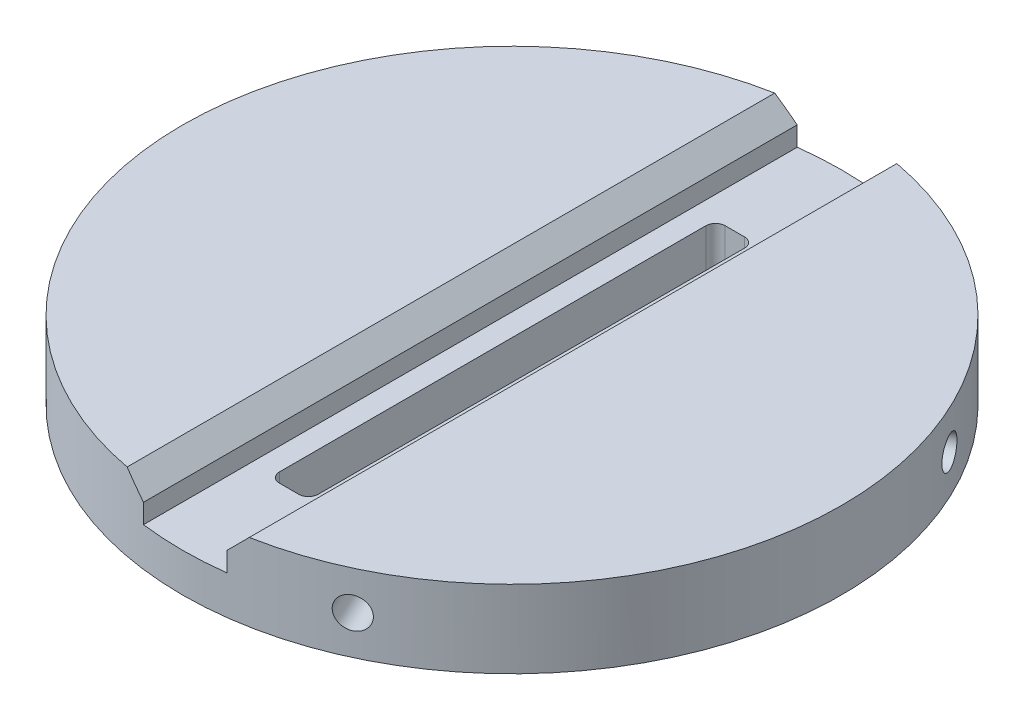
from build123d import *

# Parameters (mm, degrees)
SKETCH1_R           = 17
BOSS_EXTRUDE1_DEPTH = 4
SKETCH23_W          = 4.3
SKETCH23_H          = 36
CUT_EXTRUDE5_DEPTH  = 2
SKETCH24_W          = 2
SKETCH24_H          = 23
CUT_EXTRUDE6_DEPTH  = 25.124676164
FILLET4_R           = 0.5
CHAMFER1_SIZE       = 1
CIRPATTERN1_COUNT   = 4


with BuildPart() as part:
    # Sketch1 → Boss-Extrude1 (new body)
    with BuildSketch(Plane(origin=(0, 0, 0), x_dir=(1, 0, 0), z_dir=(0, 1, 0))):
        with Locations(Location((0, 0, 0), (0, 0, 270))):
            Circle(SKETCH1_R)
    extrude(amount=BOSS_EXTRUDE1_DEPTH)

    # Sketch23 → Cut-Extrude5 (cut)
    with BuildSketch(Plane(origin=(0, 4, 0), x_dir=(1, 0, 0), z_dir=(0, 1, 0))):
        with Locations((0, -0.174485126)):
            Rectangle(SKETCH23_W, SKETCH23_H)
    extrude(amount=-CUT_EXTRUDE5_DEPTH, mode=Mode.SUBTRACT)

    # Sketch24 → Cut-Extrude6 (cut, through all)
    with BuildSketch(Plane(origin=(0, 2, 0), x_dir=(1, 0, 0), z_dir=(0, 1, 0))):
        Rectangle(SKETCH24_W, SKETCH24_H)
    extrude(amount=-CUT_EXTRUDE6_DEPTH, mode=Mode.SUBTRACT)

    # Fillet4
    fillet4_edges = [part.edges().sort_by_distance(p)[0] for p in [
        (1, 1, -11.5),
        (1, 1, 11.5),
        (-1, 1, 11.5),
        (-1, 1, -11.5),
    ]]
    fillet(fillet4_edges, radius=FILLET4_R)

    # Chamfer1
    chamfer1_edges = [part.edges().sort_by_distance(p)[0] for p in [
        (-2.15, 4, 0),
        (2.15, 4, 0),
    ]]
    chamfer(chamfer1_edges, length=CHAMFER1_SIZE)

    # Sketch27 → M2 Tapped Hole1 (revolve, cut)
    with BuildSketch(Plane(origin=(-7.18451045, 2, -15.40723238), x_dir=(-0.9063077870366497, 0, 0.4226182617407), z_dir=(0, 1, 0))):
        Polygon((0, 0), (0, 5.680688495), (0.8, 5.2), (0.8, 0), align=None)
    m2_tapped_hole1 = revolve(axis=Axis((-9.868136412, 2, -21.162286827), (0.42261826174069994, 0, 0.9063077870366498)), mode=Mode.SUBTRACT)

    # CirPattern1: M2 Tapped Hole1 ×4 about axis
    cirpattern1_axis = Axis((0, 0, 0), (0, -1, 0))
    for i in range(1, CIRPATTERN1_COUNT):
        add(m2_tapped_hole1.rotate(cirpattern1_axis, i * 360 / CIRPATTERN1_COUNT), mode=Mode.SUBTRACT)


solid = part.part
